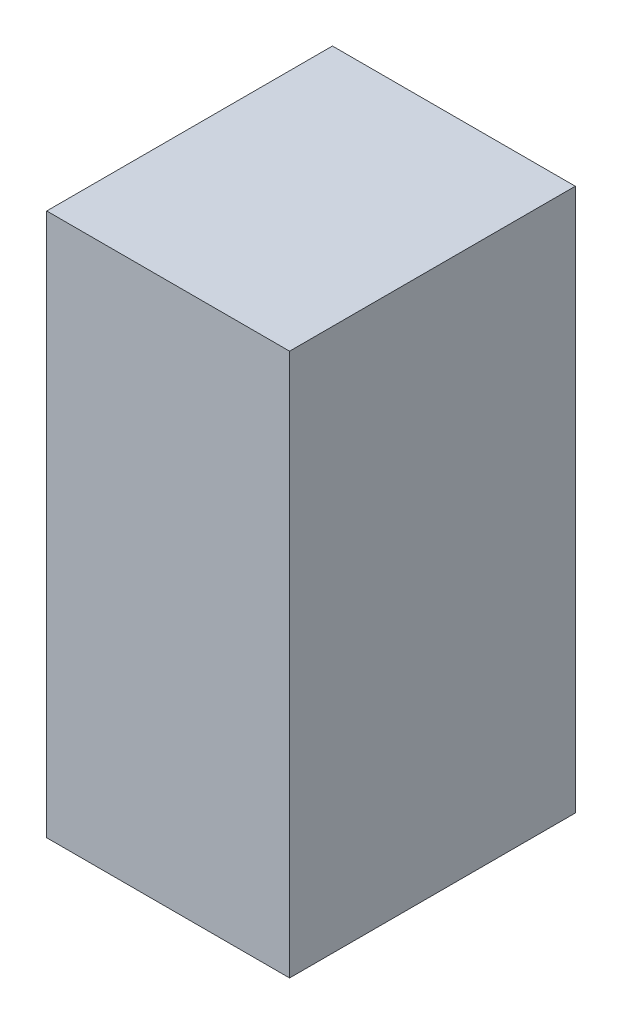
from build123d import *

# Parameters (mm, degrees)
SKETCH_2_W      = 0.085
SKETCH_2_H      = 0.19
EXTRUDE_1_DEPTH = 0.1


with BuildPart() as part:
    # 草图2 → 凸台-拉伸1 (new body)
    with BuildSketch(Plane.XY):
        Rectangle(SKETCH_2_W, SKETCH_2_H)
    extrude(amount=EXTRUDE_1_DEPTH)


solid = part.part
